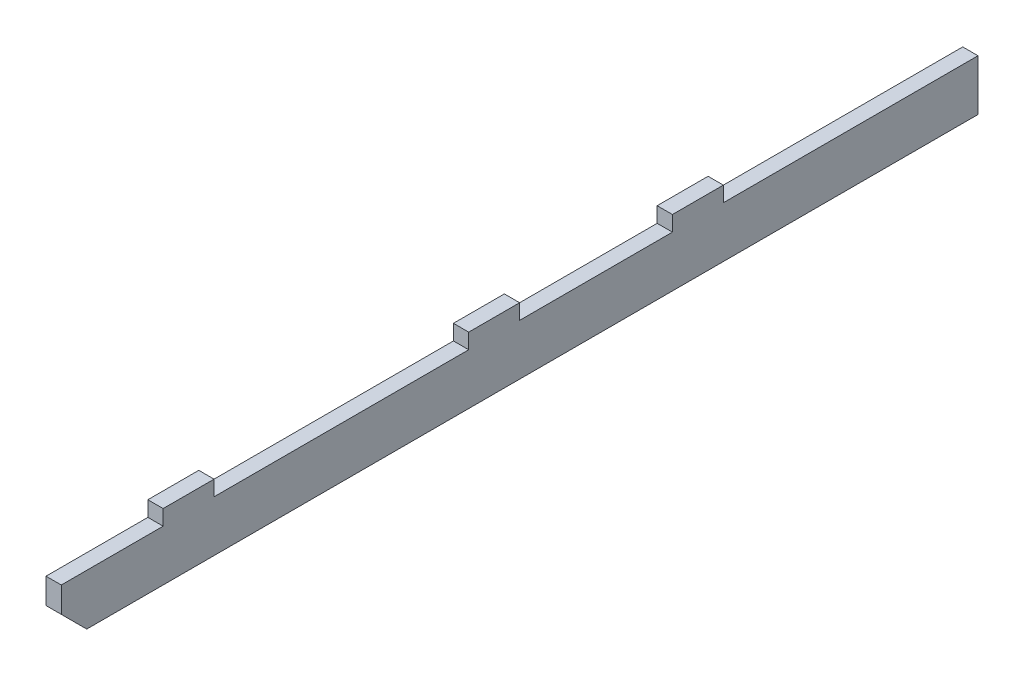
from build123d import *

# Parameters (mm, degrees)
BOSS_EXTRUDE1_DEPTH = 3
CHAMFER1_SIZE       = 5


with BuildPart() as part:
    # Sketch1 → Boss-Extrude1 (new body)
    with BuildSketch(Plane(origin=(0, 0, 0), x_dir=(0, 0, -1), z_dir=(1, 0, 0))):
        Polygon((-60, 5), (-10, 5), (-10, 8), (0, 8), (0, 5), (30, 5), (30, 8), (40, 8), (40, 5), (90, 5), (90, -5), (-90, -5), (-90, 5), (-70, 5), (-70, 8), (-60, 8), align=None)
    extrude(amount=BOSS_EXTRUDE1_DEPTH)

    # Chamfer1
    chamfer1_edges = [part.edges().sort_by_distance(p)[0] for p in [
        (1.5, -5, 90),
    ]]
    chamfer(chamfer1_edges, length=CHAMFER1_SIZE)


solid = part.part
